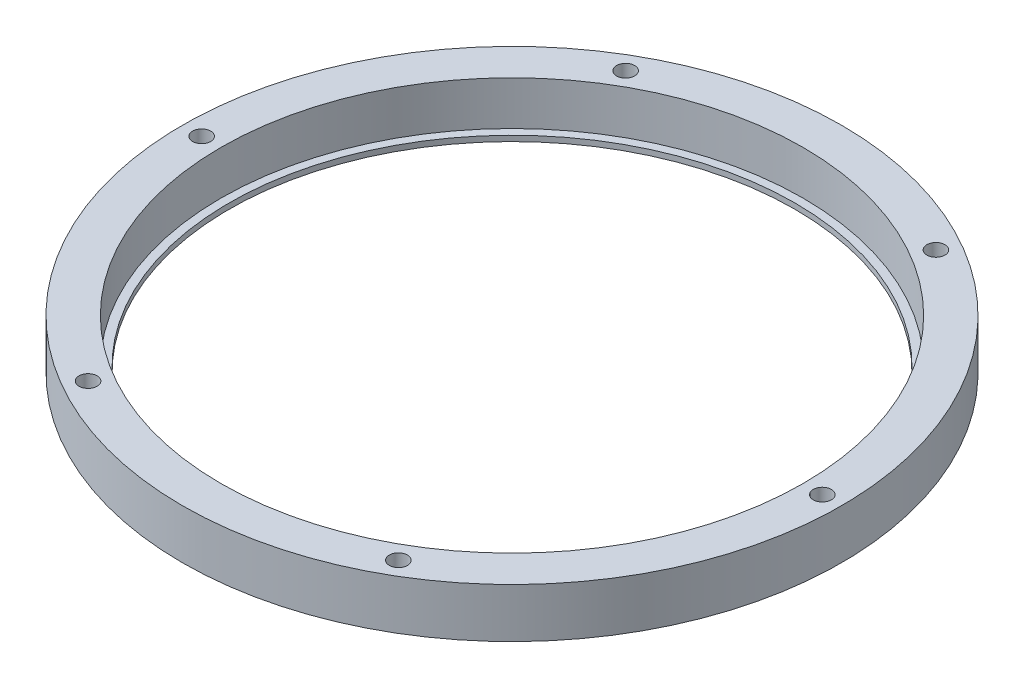
from build123d import *

# Parameters (mm, degrees)
SKETCH_2_R         = 60
SKETCH_2_R_2       = 53
EXTRUDE_1_DEPTH    = 8
EXTRUDE_START      = 1
SKETCH_3_R         = 60
SKETCH_3_R_2       = 51.5
EXTRUDE_2_DEPTH    = 1
HOLE_WIZARD_M4_1_D = 3.3


with BuildPart() as part:
    # 草图2 → 凸台-拉伸1 (new body)
    with BuildSketch(Plane(origin=(0, 0, 0), x_dir=(1, 0, 0), z_dir=(0, 1, 0))):
        with Locations(Location((0, 0, 0), (0, 0, 270))):
            Circle(SKETCH_2_R)
        with Locations(Location((0, 0, 0), (0, 0, 270))):
            Circle(SKETCH_2_R_2, mode=Mode.SUBTRACT)
    extrude(amount=EXTRUDE_1_DEPTH)

    # 草图3 → 凸台-拉伸2 (add)
    with BuildSketch(Plane.XZ.offset(EXTRUDE_START)):
        with Locations(Location((0, 0, 0), (0, 0, 270))):
            Circle(SKETCH_3_R)
        with Locations(Location((0, 0, 0), (0, 0, 270))):
            Circle(SKETCH_3_R_2, mode=Mode.SUBTRACT)
    extrude(amount=-EXTRUDE_2_DEPTH)

    # M4 螺纹孔1 (through all)
    with Locations(Plane(origin=(0, 8, 0), x_dir=(1, 0, 0), z_dir=(0, 1, 0))):
        with Locations((-28.25, 48.930435314), (28.25, 48.930435314), (56.5, 0), (28.25, -48.930435314), (-28.25, -48.930435314), (-56.5, 0)):
            Hole(HOLE_WIZARD_M4_1_D / 2)


solid = part.part
